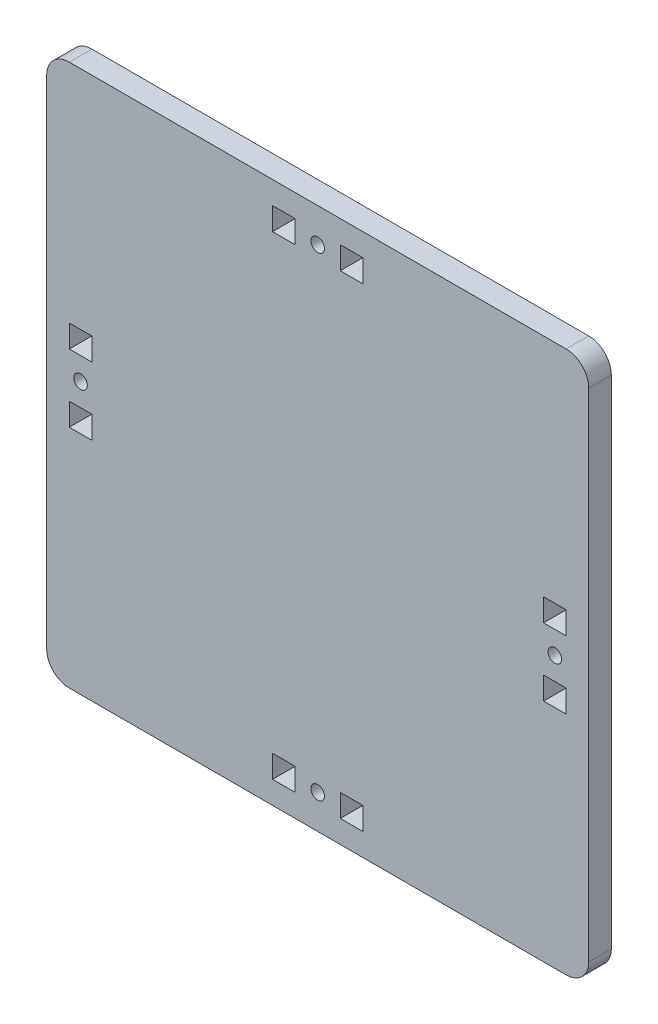
from build123d import *

# Parameters (mm, degrees)
SKETCH1_W           = 120
SKETCH1_H           = 120
SKETCH1_R           = 1.5
SKETCH1_W_2         = 5
SKETCH1_H_2         = 5
BOSS_EXTRUDE1_DEPTH = 5
FILLET1_R           = 5


with BuildPart() as part:
    # Sketch1 → Boss-Extrude1 (new body)
    with BuildSketch(Plane.XY):
        with Locations((60, 60)):
            Rectangle(SKETCH1_W, SKETCH1_H)
        with Locations((112.5, 60)):
            Circle(SKETCH1_R, mode=Mode.SUBTRACT)
        with Locations((7.5, 60)):
            Circle(SKETCH1_R, mode=Mode.SUBTRACT)
        with Locations((60, 112.5)):
            Circle(SKETCH1_R, mode=Mode.SUBTRACT)
        with Locations(Location((60, 7.5, 0), (0, 0, 90))):
            Circle(SKETCH1_R, mode=Mode.SUBTRACT)
        with Locations((112.5, 52.5)):
            Rectangle(SKETCH1_W_2, SKETCH1_H_2, mode=Mode.SUBTRACT)
        with Locations((112.5, 67.5)):
            Rectangle(SKETCH1_W_2, SKETCH1_H_2, mode=Mode.SUBTRACT)
        with Locations((7.5, 52.5)):
            Rectangle(SKETCH1_W_2, SKETCH1_H_2, mode=Mode.SUBTRACT)
        with Locations((7.5, 67.5)):
            Rectangle(SKETCH1_W_2, SKETCH1_H_2, mode=Mode.SUBTRACT)
        with Locations((67.5, 112.5)):
            Rectangle(SKETCH1_W_2, SKETCH1_H_2, mode=Mode.SUBTRACT)
        with Locations((52.5, 112.5)):
            Rectangle(SKETCH1_W_2, SKETCH1_H_2, mode=Mode.SUBTRACT)
        with Locations((67.5, 7.5)):
            Rectangle(SKETCH1_W_2, SKETCH1_H_2, mode=Mode.SUBTRACT)
        with Locations((52.5, 7.5)):
            Rectangle(SKETCH1_W_2, SKETCH1_H_2, mode=Mode.SUBTRACT)
    extrude(amount=BOSS_EXTRUDE1_DEPTH)

    # Fillet1
    fillet1_edges = [part.edges().sort_by_distance(p)[0] for p in [
        (0, 120, 2.5),
        (120, 120, 2.5),
        (120, 0, 2.5),
        (0, 0, 2.5),
    ]]
    fillet(fillet1_edges, radius=FILLET1_R)


solid = part.part
